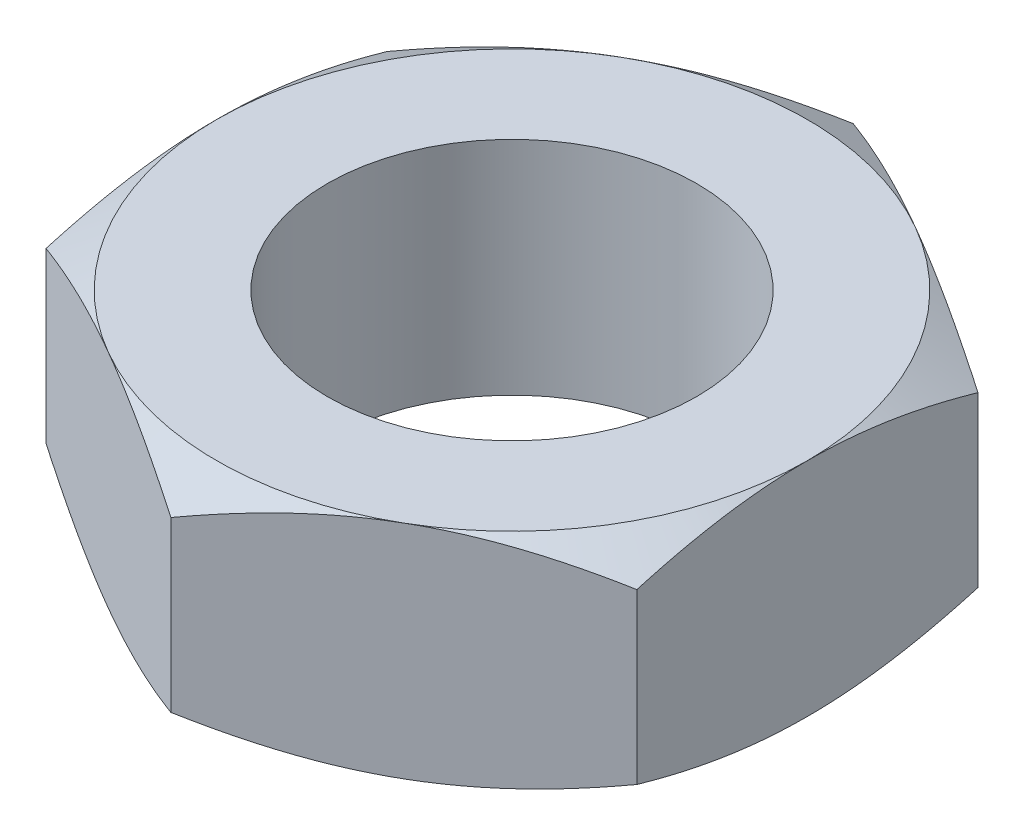
from build123d import *

# Parameters (mm, degrees)
SKETCH1_R               = 3.96875
BOSS_EXTRUDE1_DEPTH     = 2.38125
SKETCH5_OUTSIDE_W       = 59.592
SKETCH5_OUTSIDE_H       = 61.556
SKETCH5_OUTSIDE_R       = 6.35
CUT_EXTRUDE2_DEPTH      = 11.805889116
CUT_EXTRUDE2_DRAFT      = -60
MIRROR1_COPY_1_SKETCH_W = 59.592
MIRROR1_COPY_1_SKETCH_H = 61.556
MIRROR1_COPY_1_SKETCH_R = 6.35
MIRROR1_COPY_1_DEPTH    = 11.805889116
MIRROR1_COPY_1_DRAFT    = -60


with BuildPart() as part:
    # Sketch1 → Boss-Extrude1 (new, symmetric)
    with BuildSketch(Plane(origin=(0, 0, 0), x_dir=(1, 0, 0), z_dir=(0, 1, 0))):
        Polygon((-6.35, 3.666174209), (-6.35, -3.666174209), (0, -7.332348419), (6.35, -3.666174209), (6.35, 3.666174209), (0, 7.332348419), align=None)
        Circle(SKETCH1_R, mode=Mode.SUBTRACT)
    extrude(amount=BOSS_EXTRUDE1_DEPTH, both=True)


with BuildPart() as cut_extrude2_tool:
    # Sketch5 outside → Cut-Extrude2 (with draft: the straight prism first)
    with BuildSketch(Plane(origin=(0, 2.38125, 0), x_dir=(1, 0, 0), z_dir=(0, 1, 0))):
        Rectangle(SKETCH5_OUTSIDE_W, SKETCH5_OUTSIDE_H)
        Circle(SKETCH5_OUTSIDE_R, mode=Mode.SUBTRACT)
    extrude(amount=-CUT_EXTRUDE2_DEPTH)
    # Cut-Extrude2: the draft: its side faces are tilted about the plane it starts from
    cut_extrude2_sides = [cut_extrude2_tool.faces().sort_by_distance(p)[0] for p in [
        (0, -3.521694558, 30.778),
        (29.796, -3.521694558, 0),
        (0, -3.521694558, -30.778),
        (-29.796, -3.521694558, 0),
        (-6.35, -3.521694558, 0),
    ]]
    draft(cut_extrude2_sides, Plane(origin=(0, 2.38125, 0), x_dir=(1, 0, 0), z_dir=(0, 1, 0)), CUT_EXTRUDE2_DRAFT)


with BuildPart() as part_1:
    add(part.part)

    # Cut-Extrude2: cut by cut_extrude2_tool
    add(cut_extrude2_tool.part, mode=Mode.SUBTRACT)


with BuildPart() as mirror1_copy_1_tool:
    # Mirror1 copy 1 sketch → Mirror1 copy 1 (with draft: the straight prism first)
    with BuildSketch(Plane.XZ.offset(2.38125)):
        Rectangle(MIRROR1_COPY_1_SKETCH_W, MIRROR1_COPY_1_SKETCH_H)
        Circle(MIRROR1_COPY_1_SKETCH_R, mode=Mode.SUBTRACT)
    extrude(amount=-MIRROR1_COPY_1_DEPTH)
    # Mirror1 copy 1: the draft: its side faces are tilted about the plane it starts from
    mirror1_copy_1_sides = [mirror1_copy_1_tool.faces().sort_by_distance(p)[0] for p in [
        (0, 3.521694558, 30.778),
        (29.796, 3.521694558, 0),
        (0, 3.521694558, -30.778),
        (-29.796, 3.521694558, 0),
        (-6.35, 3.521694558, 0),
    ]]
    draft(mirror1_copy_1_sides, Plane.XZ.offset(2.38125), MIRROR1_COPY_1_DRAFT)


with BuildPart() as part_2:
    add(part_1.part)

    # Mirror1 copy 1: cut by mirror1_copy_1_tool
    add(mirror1_copy_1_tool.part, mode=Mode.SUBTRACT)


solid = part_2.part
